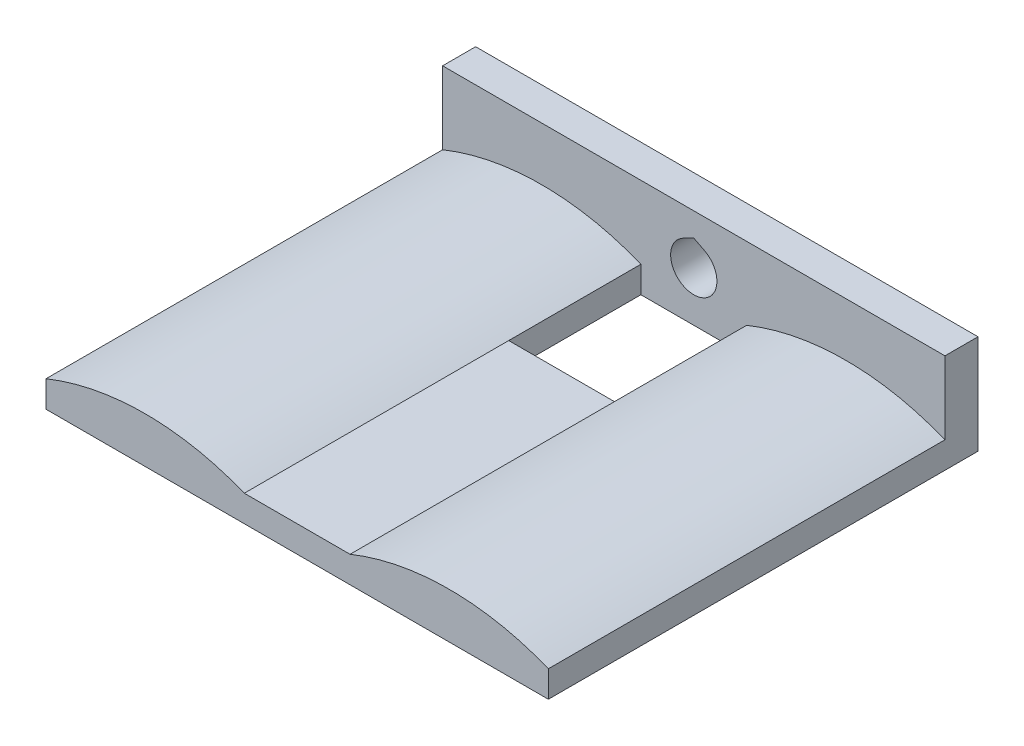
from build123d import *

# Parameters (mm, degrees)
SKETCH1_W           = 38
SKETCH1_H           = 7.5
BOSS_EXTRUDE1_DEPTH = 2.5
BOSS_EXTRUDE5_DEPTH = 30
SKETCH7_W           = 8
SKETCH7_H           = 2
BOSS_EXTRUDE6_DEPTH = 20


with BuildPart() as part:
    # Sketch1 → Boss-Extrude1 (new body)
    with BuildSketch(Plane.XY):
        Rectangle(SKETCH1_W, SKETCH1_H)
        with BuildLine():
            Line((0, 1.961391495), (0.790288933, 1.561391495))
            ThreePointArc((0.790288933, 1.561391495), (0, -1.75), (-0.790288933, 1.561391495))
            Line((-0.790288933, 1.561391495), (0, 1.961391495))
        make_face(mode=Mode.SUBTRACT)
    extrude(amount=BOSS_EXTRUDE1_DEPTH)

    # Sketch6 → Boss-Extrude5 (add)
    with BuildSketch(Plane.XY.offset(2.5)):
        with BuildLine():
            Line((-19, -3.75), (-19, -1.75))
            ThreePointArc((-19, -1.75), (-11.5, -0.290496218), (-4, -1.75))
            Line((-4, -1.75), (-4, -3.75))
            Line((-4, -3.75), (-19, -3.75))
        make_face()
    boss_extrude5 = extrude(amount=BOSS_EXTRUDE5_DEPTH)

    # Mirror1: Boss-Extrude5 across plane
    add(boss_extrude5.mirror(Plane(origin=(0, 0, 0), x_dir=(0, 0, 1), z_dir=(1, 0, 0))))

    # Sketch7 → Boss-Extrude6 (add)
    with BuildSketch(Plane.XY.offset(32.5)):
        with Locations((0, -2.75)):
            Rectangle(SKETCH7_W, SKETCH7_H)
    extrude(amount=-BOSS_EXTRUDE6_DEPTH)


solid = part.part
